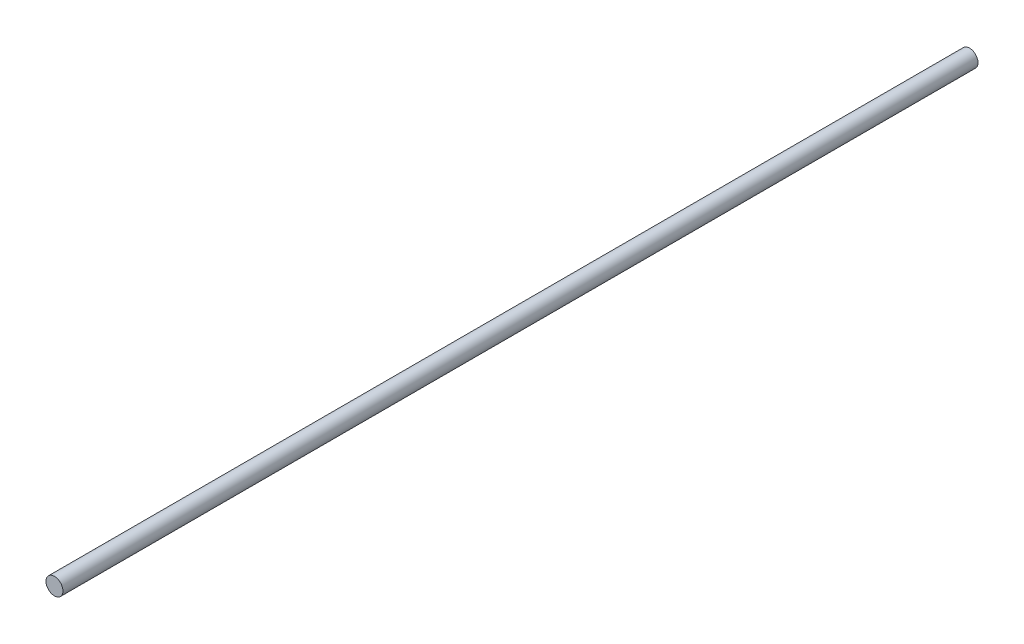
from build123d import *

# Parameters (mm, degrees)
SKETCH_1_R      = 3
EXTRUDE_1_DEPTH = 323.71


with BuildPart() as part:
    # 草图1 → 凸台-拉伸1 (new body)
    with BuildSketch(Plane.XY):
        Circle(SKETCH_1_R)
    extrude(amount=EXTRUDE_1_DEPTH)


solid = part.part
